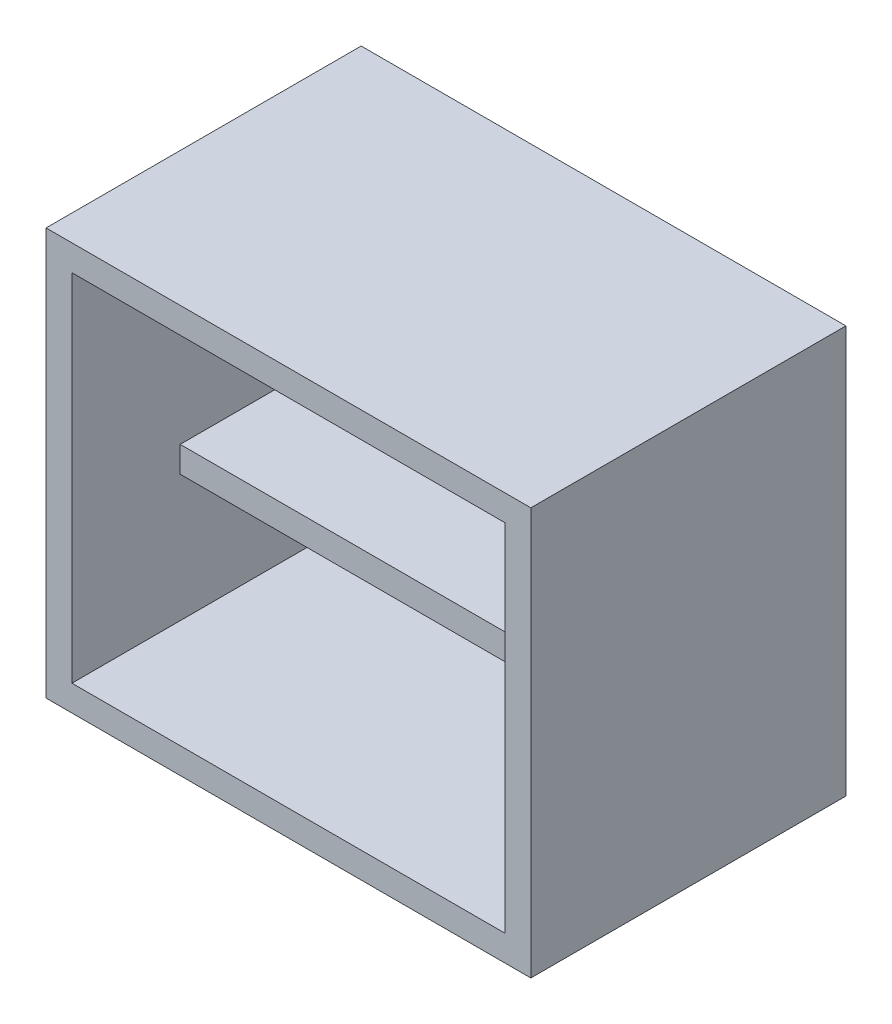
from build123d import *

# Parameters (mm, degrees)
CROQUIS1_W              = 300
CROQUIS1_H              = 195
SALIENTE_EXTRUIR1_DEPTH = 16
CROQUIS2_W              = 16
CROQUIS2_H              = 195
SALIENTE_EXTRUIR2_DEPTH = 220
CROQUIS7_W              = 300
CROQUIS7_H              = 195
SALIENTE_EXTRUIR4_DEPTH = 16
CROQUIS8_W              = 268
CROQUIS8_H              = 128
SALIENTE_EXTRUIR5_DEPTH = 16
CROQUIS11_W             = 41
CROQUIS11_H             = 35
SALIENTE_EXTRUIR6_DEPTH = 20


with BuildPart() as part:
    # Croquis1 → Saliente-Extruir1 (new body)
    with BuildSketch(Plane(origin=(0, 0, 0), x_dir=(1, 0, 0), z_dir=(0, 1, 0))):
        Rectangle(CROQUIS1_W, CROQUIS1_H)
    extrude(amount=SALIENTE_EXTRUIR1_DEPTH)

    # Croquis2 → Saliente-Extruir2 (add)
    with BuildSketch(Plane(origin=(0, 16, 0), x_dir=(1, 0, 0), z_dir=(0, 1, 0))):
        with Locations((-142, 0)):
            Rectangle(CROQUIS2_W, CROQUIS2_H)
        with Locations((142, 0)):
            Rectangle(CROQUIS2_W, CROQUIS2_H)
    extrude(amount=SALIENTE_EXTRUIR2_DEPTH)

    # Croquis7 → Saliente-Extruir4 (add)
    with BuildSketch(Plane(origin=(0, 236, 0), x_dir=(1, 0, 0), z_dir=(0, 1, 0))):
        Rectangle(CROQUIS7_W, CROQUIS7_H)
    extrude(amount=SALIENTE_EXTRUIR4_DEPTH)

    # Croquis8 → Saliente-Extruir5 (add)
    with BuildSketch(Plane(origin=(0, 94.5, 0), x_dir=(1, 0, 0), z_dir=(0, 1, 0))):
        with Locations((0, 33.5)):
            Rectangle(CROQUIS8_W, CROQUIS8_H)
    extrude(amount=SALIENTE_EXTRUIR5_DEPTH)

    # Croquis11 → Saliente-Extruir6 (add)
    with BuildSketch(Plane(origin=(0, 110.5, 0), x_dir=(1, 0, 0), z_dir=(0, 1, 0))):
        with Locations((10.868818232, 64.486978539)):
            Rectangle(CROQUIS11_W, CROQUIS11_H)
    extrude(amount=SALIENTE_EXTRUIR6_DEPTH)


solid = part.part
